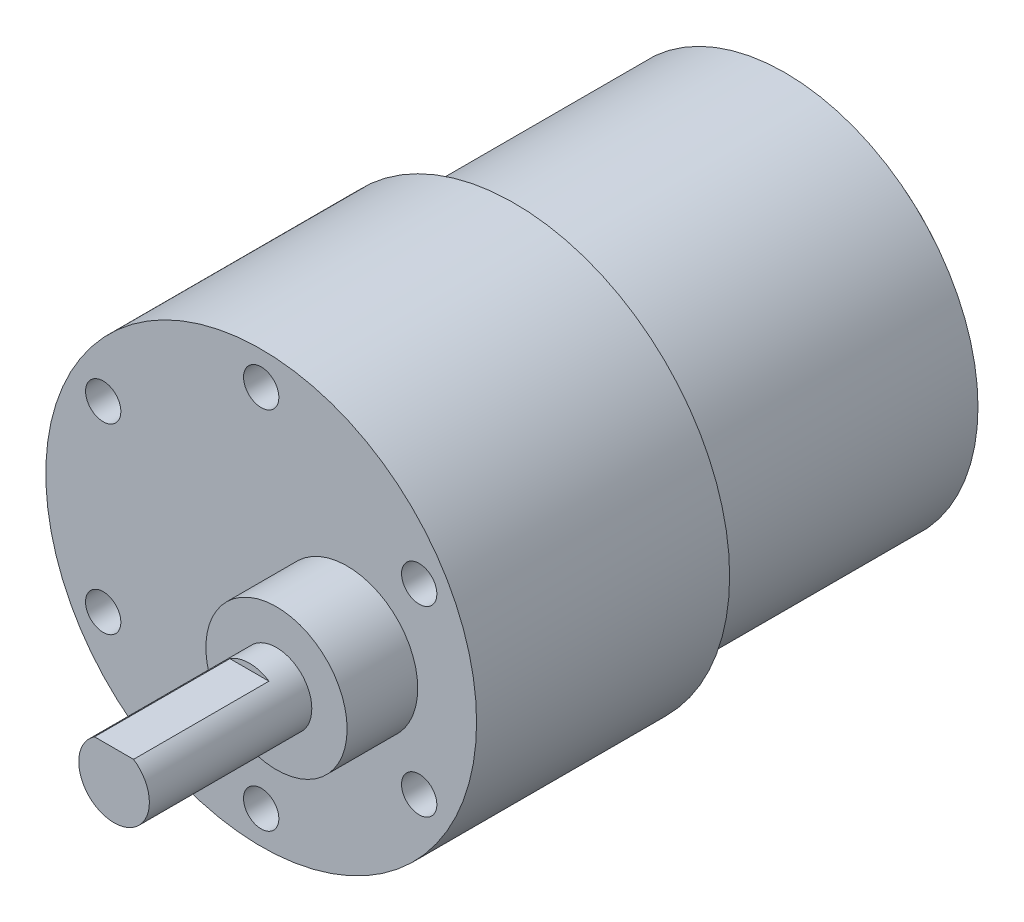
from build123d import *

# Parameters (mm, degrees)
SKETCH_1_R          = 18.3
EXTRUDE_1_DEPTH     = 21.5
SKETCH_2_R          = 1.5
CUT_EXTRUDE_1_DEPTH = 5
SKETCH_3_R          = 6
EXTRUDE_2_DEPTH     = 6
SKETCH_4_R          = 3
EXTRUDE_3_DEPTH     = 13.8
CUT_EXTRUDE_START   = -11.5
CUT_EXTRUDE_2_DEPTH = 11.5
SKETCH_6_R          = 16.4
EXTRUDE_4_DEPTH     = 23
SKETCH_7_R          = 15
EXTRUDE_5_DEPTH     = 1
SKETCH_8_R          = 3
EXTRUDE_6_DEPTH     = 4
SKETCH_9_W          = 12.161670498
SKETCH_9_H          = 4.500444444
EXTRUDE_7_DEPTH     = 7.9
SKETCH_10_W         = 1.2
SKETCH_10_H         = 2.711111112
EXTRUDE_8_DEPTH     = 4
SKETCH_11_W         = 10.179858782
SKETCH_11_H         = 6.369590588
CUT_EXTRUDE_3_DEPTH = 6


with BuildPart() as part:
    # 草图1 → 凸台-拉伸1 (new body)
    with BuildSketch(Plane.XY):
        Circle(SKETCH_1_R)
    extrude(amount=EXTRUDE_1_DEPTH)

    # 草图2 → 切除-拉伸1 (cut)
    with BuildSketch(Plane.XY.offset(21.5)):
        with Locations((0, 15.5)):
            Circle(SKETCH_2_R)
        with Locations((13.423393759, 7.75)):
            Circle(SKETCH_2_R)
        with Locations((13.423393759, -7.75)):
            Circle(SKETCH_2_R)
        with Locations((0, -15.5)):
            Circle(SKETCH_2_R)
        with Locations((-13.423393759, -7.75)):
            Circle(SKETCH_2_R)
        with Locations((-13.423393759, 7.75)):
            Circle(SKETCH_2_R)
    extrude(amount=-CUT_EXTRUDE_1_DEPTH, mode=Mode.SUBTRACT)

    # 草图3 → 凸台-拉伸2 (add)
    with BuildSketch(Plane.XY.offset(21.5)):
        with Locations((7.3, 0)):
            Circle(SKETCH_3_R)
    extrude(amount=EXTRUDE_2_DEPTH)

    # 草图4 → 凸台-拉伸3 (add)
    with BuildSketch(Plane.XY.offset(27.5)):
        with Locations(Location((7.3, 0, 0), (0, 0, 180))):
            Circle(SKETCH_4_R)
    extrude(amount=EXTRUDE_3_DEPTH)

    # 草图5 → 切除-拉伸2 (cut)
    with BuildSketch(Plane.XY.offset(41.3).offset(CUT_EXTRUDE_START)):
        with BuildLine():
            Line((5.641687605, 2.5), (8.958312395, 2.5))
            ThreePointArc((8.958312395, 2.5), (7.3, 3), (5.641687605, 2.5))
        make_face()
    extrude(amount=CUT_EXTRUDE_2_DEPTH, mode=Mode.SUBTRACT)

    # 草图6 → 凸台-拉伸4 (add)
    with BuildSketch(Plane(origin=(0, 0, 0), x_dir=(-1, 0, 0), z_dir=(0, 0, -1))):
        Circle(SKETCH_6_R)
    extrude(amount=EXTRUDE_4_DEPTH)

    # 草图7 → 凸台-拉伸5 (add)
    with BuildSketch(Plane(origin=(0, 0, -23), x_dir=(-1, 0, 0), z_dir=(0, 0, -1))):
        Circle(SKETCH_7_R)
    extrude(amount=EXTRUDE_5_DEPTH)

    # 草图8 → 凸台-拉伸6 (add)
    with BuildSketch(Plane(origin=(0, 0, -24), x_dir=(-1, 0, 0), z_dir=(0, 0, -1))):
        Circle(SKETCH_8_R)
    extrude(amount=EXTRUDE_6_DEPTH)

    # 草图9 → 凸台-拉伸7 (add)
    with BuildSketch(Plane(origin=(0, 0, -24), x_dir=(-1, 0, 0), z_dir=(0, 0, -1))):
        with Locations((0, -11.791042912)):
            Rectangle(SKETCH_9_W, SKETCH_9_H)
    extrude(amount=EXTRUDE_7_DEPTH)

    # 草图10 → 凸台-拉伸8 (add)
    with BuildSketch(Plane(origin=(0, 0, -24), x_dir=(-1, 0, 0), z_dir=(0, 0, -1))):
        with Locations((-5.289655172, 0)):
            Rectangle(SKETCH_10_W, SKETCH_10_H)
        with Locations((5.835249042, 0)):
            Rectangle(SKETCH_10_W, SKETCH_10_H)
    extrude(amount=EXTRUDE_8_DEPTH)

    # 草图11 → 切除-拉伸3 (cut)
    with BuildSketch(Plane(origin=(0, 0, -31.9), x_dir=(-1, 0, 0), z_dir=(0, 0, -1))):
        with Locations((0, -14.041265134)):
            Rectangle(SKETCH_11_W, SKETCH_11_H)
    extrude(amount=-CUT_EXTRUDE_3_DEPTH, mode=Mode.SUBTRACT)


solid = part.part
